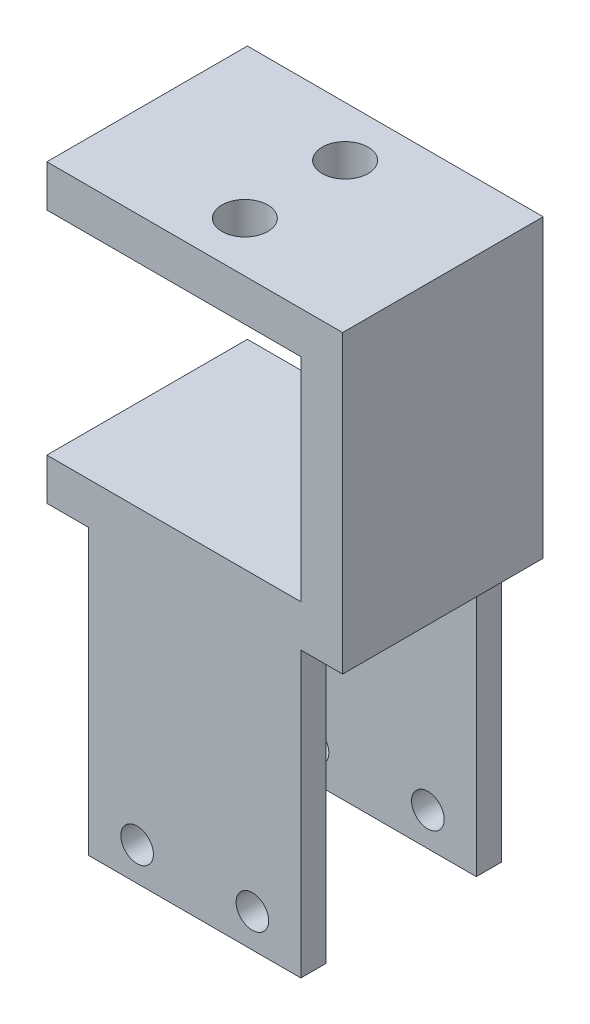
from build123d import *

# Parameters (mm, degrees)
SKETCH1_R           = 1.95
SKETCH1_W           = 25.4
SKETCH1_H           = 25.4
BOSS_EXTRUDE1_DEPTH = 24
SKETCH3_W           = 18
SKETCH3_H           = 34
CUT_EXTRUDE1_DEPTH  = 56.518645517
CUT_EXTRUDE2_REACH  = 83.52
SKETCH4_R           = 2.75
SKETCH5_W           = 5
SKETCH5_H           = 25.4
CUT_EXTRUDE3_DEPTH  = 56.518645517


with BuildPart() as part:
    # Sketch1 → Boss-Extrude1 (new body)
    with BuildSketch(Plane.XY):
        Polygon((0, 0), (0, 35.4), (-35.4, 35.4), (-35.4, 0), (-30.4, 0), (-30.4, -34), (-5, -34), (-5, 0), align=None)
        with Locations((-24.6, -30)):
            Circle(SKETCH1_R, mode=Mode.SUBTRACT)
        with Locations((-10.8, -30)):
            Circle(SKETCH1_R, mode=Mode.SUBTRACT)
        with Locations((-17.7, 17.7)):
            Rectangle(SKETCH1_W, SKETCH1_H, mode=Mode.SUBTRACT)
    extrude(amount=BOSS_EXTRUDE1_DEPTH)

    # Sketch3 → Cut-Extrude1 (cut, through all)
    with BuildSketch(Plane.ZY.offset(35.4)):
        with Locations((12, -17)):
            Rectangle(SKETCH3_W, SKETCH3_H)
    extrude(amount=-CUT_EXTRUDE1_DEPTH, mode=Mode.SUBTRACT)

    # Sketch4 → Cut-Extrude2 (cut, up to next)
    with BuildSketch(Plane(origin=(0, 35.4, 0), x_dir=(1, 0, 0), z_dir=(0, 1, 0)), mode=Mode.PRIVATE) as cut_extrude2_sk1:
        with Locations(Location((-17.7, -6, 0), (0, 0, 180))):
            Circle(SKETCH4_R)
    cut_extrude2_tool1 = extrude(cut_extrude2_sk1.sketch, amount=-CUT_EXTRUDE2_REACH, mode=Mode.PRIVATE) & part.part
    # Sketch4 → Cut-Extrude2 (cut, up to next)
    with BuildSketch(Plane(origin=(0, 35.4, 0), x_dir=(1, 0, 0), z_dir=(0, 1, 0)), mode=Mode.PRIVATE) as cut_extrude2_sk2:
        with Locations(Location((-17.7, -18, 0), (0, 0, 180))):
            Circle(SKETCH4_R)
    cut_extrude2_tool2 = extrude(cut_extrude2_sk2.sketch, amount=-CUT_EXTRUDE2_REACH, mode=Mode.PRIVATE) & part.part
    add(cut_extrude2_tool1.solids().sort_by_distance((-17.7, 35.4, 6))[0], mode=Mode.SUBTRACT)
    add(cut_extrude2_tool2.solids().sort_by_distance((-17.7, 35.4, 18))[0], mode=Mode.SUBTRACT)

    # Sketch5 → Cut-Extrude3 (cut, through all)
    with BuildSketch(Plane(origin=(0, 0, 0), x_dir=(-1, 0, 0), z_dir=(0, 0, -1))):
        with Locations((32.9, 17.7)):
            Rectangle(SKETCH5_W, SKETCH5_H)
    extrude(amount=-CUT_EXTRUDE3_DEPTH, mode=Mode.SUBTRACT)


solid = part.part
